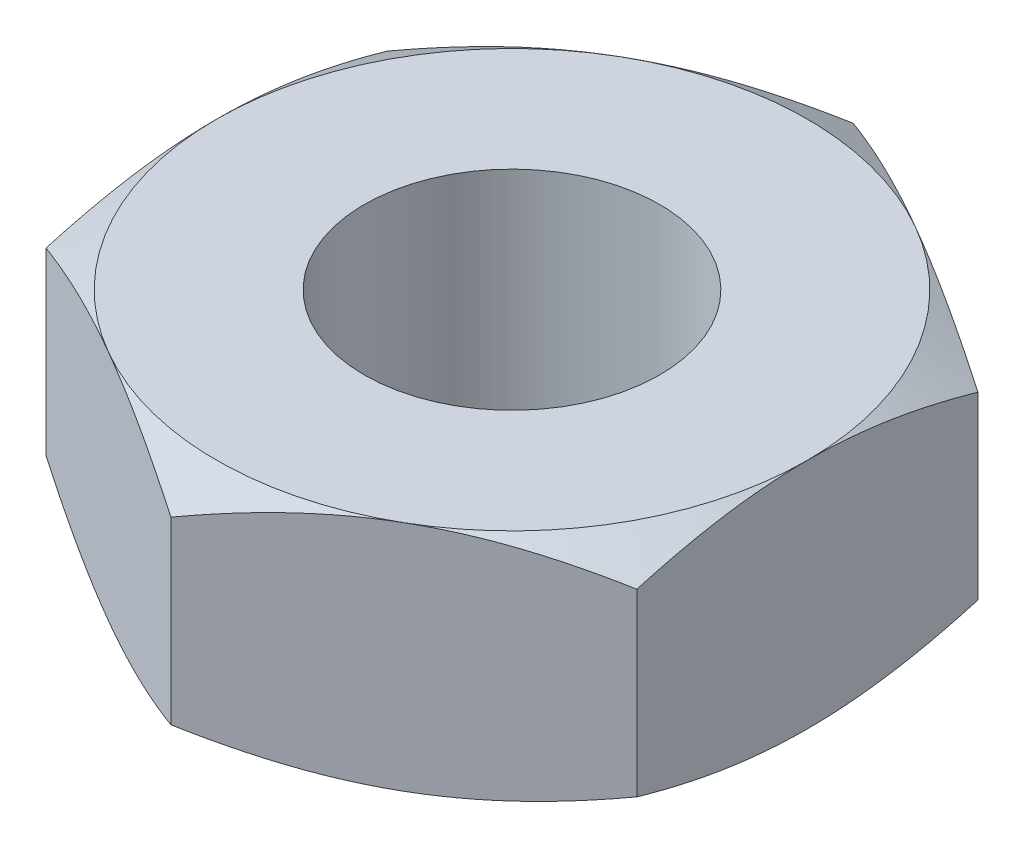
from build123d import *

# Parameters (mm, degrees)
SKETCH2_R           = 6.35
BOSS_EXTRUDE1_DEPTH = 5


with BuildPart() as part:
    # Sketch2 → Boss-Extrude1 (new, symmetric)
    with BuildSketch(Plane(origin=(0, 0, 0), x_dir=(1, 0, 0), z_dir=(0, 1, 0))):
        Polygon((0, -14.664696837), (12.7, -7.332348419), (12.7, 7.332348419), (0, 14.664696837), (-12.7, 7.332348419), (-12.7, -7.332348419), align=None)
        with Locations(Location((0, 0, 0), (0, 0, 270))):
            Circle(SKETCH2_R, mode=Mode.SUBTRACT)
    extrude(amount=BOSS_EXTRUDE1_DEPTH, both=True)

    # Sketch3 → Cut-Revolve1 (revolve, cut)
    with BuildSketch(Plane.XY):
        Polygon((12.7, 5), (15.7, 5), (15.7, 3.267949192), align=None)
        Polygon((12.7, -5), (15.7, -5), (15.7, -3.267949192), align=None)
    revolve(axis=Axis((0, 0, 0), (0, -1, 0)), mode=Mode.SUBTRACT)


solid = part.part
